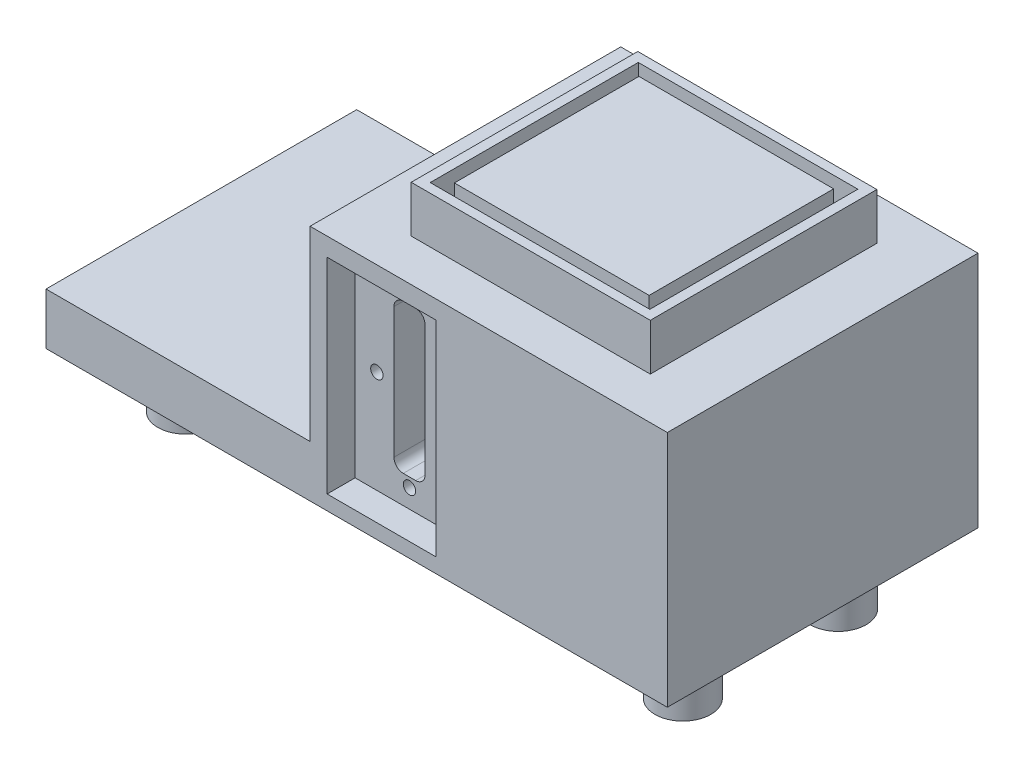
from build123d import *

# Parameters (mm, degrees)
SKETCH1_W            = 115
SKETCH1_H            = 100
BOSS_EXTRUDE1_DEPTH  = 40
SKETCH8_R            = 7
SKETCH8_R_2          = 6
BOSS_EXTRUDE4_DEPTH  = 20
SKETCH9_W            = 200
SKETCH9_H            = 100
BOSS_EXTRUDE5_DEPTH  = 16.6
SKETCH10_R           = 9
SKETCH10_R_2         = 10
BOSS_EXTRUDE7_DEPTH  = 20
SKETCH17_W           = 15
SKETCH17_H           = 100
BOSS_EXTRUDE15_DEPTH = 20
SKETCH15_R           = 14.5
CUT_EXTRUDE2_DEPTH   = 10
SKETCH21_R           = 2
SKETCH21_R_2         = 6.075
CUT_EXTRUDE3_DEPTH   = 20
SKETCH28_W           = 100
SKETCH28_H           = 100
BOSS_EXTRUDE16_DEPTH = 20
SKETCH19_R           = 2
CUT_EXTRUDE4_DEPTH   = 40
SKETCH11_W           = 76.96
SKETCH11_H           = 72.932737716
SKETCH11_W_2         = 70.68
SKETCH11_H_2         = 66.981365666
SKETCH11_W_3         = 62.68
SKETCH11_H_3         = 59.4
BOSS_EXTRUDE17_DEPTH = 15
SKETCH35_W           = 15
SKETCH35_H           = 3
SKETCH35_W_2         = 3
SKETCH35_H_2         = 15
CUT_EXTRUDE14_DEPTH  = 3
SKETCH36_W           = 10
SKETCH36_H           = 48
CUT_EXTRUDE15_DEPTH  = 32
CUT_EXTRUDE16_DEPTH  = 3
FILLET1_R            = 3
SKETCH42_W           = 35
SKETCH42_H           = 66
CUT_EXTRUDE20_DEPTH  = 9
SKETCH43_R           = 2
CUT_EXTRUDE21_DEPTH  = 9
SKETCH45_W           = 10
SKETCH45_H           = 48
CUT_EXTRUDE22_DEPTH  = 32
CUT_EXTRUDE23_DEPTH  = 3
FILLET2_R            = 3
SKETCH47_W           = 35
SKETCH47_H           = 66
CUT_EXTRUDE24_DEPTH  = 9
SKETCH48_R           = 2
CUT_EXTRUDE25_DEPTH  = 9


with BuildPart() as part:
    # Sketch1 → Boss-Extrude1 (new body)
    with BuildSketch(Plane(origin=(0, 0, 0), x_dir=(1, 0, 0), z_dir=(0, 1, 0))):
        Rectangle(SKETCH1_W, SKETCH1_H)
    extrude(amount=BOSS_EXTRUDE1_DEPTH)

    # Sketch8 → Boss-Extrude4 (add)
    with BuildSketch(Plane.XZ):
        with Locations(Location((0, 0, 0), (0, 0, 90))):
            Circle(SKETCH8_R)
        with Locations(Location((42.407889557, -36.876425702, 0), (0, 0, 90))):
            Circle(SKETCH8_R_2)
        with Locations(Location((42.407889557, 36.876425702, 0), (0, 0, 90))):
            Circle(SKETCH8_R_2)
    extrude(amount=BOSS_EXTRUDE4_DEPTH)

    # Sketch9 → Boss-Extrude5 (add)
    with BuildSketch(Plane.XZ.offset(20)):
        with Locations((-42.5, 0)):
            Rectangle(SKETCH9_W, SKETCH9_H)
    extrude(amount=BOSS_EXTRUDE5_DEPTH)

    # Sketch10 → Boss-Extrude7 (add)
    with BuildSketch(Plane.XZ.offset(36.6)):
        with Locations(Location((37.5, -25, 0), (0, 0, 270))):
            Circle(SKETCH10_R)
        with Locations(Location((-122.5, -25, 0), (0, 0, 90))):
            Circle(SKETCH10_R)
        with Locations(Location((-122.5, 25, 0), (0, 0, 270))):
            Circle(SKETCH10_R)
        with Locations(Location((37.5, 25, 0), (0, 0, 90))):
            Circle(SKETCH10_R)
        with Locations(Location((-42.5, 0, 0), (0, 0, 270))):
            Circle(SKETCH10_R_2)
    extrude(amount=BOSS_EXTRUDE7_DEPTH)

    # Sketch17 → Boss-Extrude15 (add)
    with BuildSketch(Plane.XZ):
        with Locations((-50, 0)):
            Rectangle(SKETCH17_W, SKETCH17_H)
    extrude(amount=BOSS_EXTRUDE15_DEPTH)

    # Sketch15 → Cut-Extrude2 (cut)
    with BuildSketch(Plane(origin=(0, -20, 0), x_dir=(1, 0, 0), z_dir=(0, 1, 0))):
        with Locations(Location((-79, 0, 0), (0, 0, 270))):
            Circle(SKETCH15_R)
    extrude(amount=-CUT_EXTRUDE2_DEPTH, mode=Mode.SUBTRACT)

    # Sketch21 → Cut-Extrude3 (cut)
    with BuildSketch(Plane(origin=(0, -30, 0), x_dir=(1, 0, 0), z_dir=(0, 1, 0))):
        with Locations(Location((-90, 0, 0), (0, 0, 270))):
            Circle(SKETCH21_R)
        with Locations(Location((-68, 0, 0), (0, 0, 270))):
            Circle(SKETCH21_R)
        with Locations(Location((-79, 0, 0), (0, 0, 270))):
            Circle(SKETCH21_R_2)
    extrude(amount=-CUT_EXTRUDE3_DEPTH, mode=Mode.SUBTRACT)

    # Sketch28 → Boss-Extrude16 (add)
    with BuildSketch(Plane.XZ):
        with Locations((7.5, 0)):
            Rectangle(SKETCH28_W, SKETCH28_H)
    extrude(amount=BOSS_EXTRUDE16_DEPTH)

    # Sketch19 → Cut-Extrude4 (cut)
    with BuildSketch(Plane.ZY.offset(57.5)):
        with Locations((-27.33, -16)):
            Circle(SKETCH19_R)
        with Locations((-27.33, 10)):
            Circle(SKETCH19_R)
        with Locations(Location((27.33, -16, 0), (0, 0, 180))):
            Circle(SKETCH19_R)
        with Locations(Location((27.33, 10, 0), (0, 0, 180))):
            Circle(SKETCH19_R)
    extrude(amount=-CUT_EXTRUDE4_DEPTH, mode=Mode.SUBTRACT)

    # Sketch11 → Boss-Extrude17 (add)
    # profile 1 of 2: a face of its own
    with BuildSketch(Plane(origin=(0, 40, 0), x_dir=(1, 0, 0), z_dir=(0, 1, 0))):
        Rectangle(SKETCH11_W, SKETCH11_H)
        Rectangle(SKETCH11_W_2, SKETCH11_H_2, mode=Mode.SUBTRACT)
    # profile 2 of 2: a face of its own
    with BuildSketch(Plane(origin=(0, 40, 0), x_dir=(1, 0, 0), z_dir=(0, 1, 0))):
        Rectangle(SKETCH11_W_3, SKETCH11_H_3)
    extrude(amount=BOSS_EXTRUDE17_DEPTH)

    # Sketch35 → Cut-Extrude14 (cut)
    with BuildSketch(Plane(origin=(0, 40, 0), x_dir=(1, 0, 0), z_dir=(0, 1, 0))):
        with Locations((-15.2, -31.590682833)):
            Rectangle(SKETCH35_W, SKETCH35_H)
        with Locations((-15.2, 31.590682833)):
            Rectangle(SKETCH35_W, SKETCH35_H)
        with Locations((15.2, -31.590682833)):
            Rectangle(SKETCH35_W, SKETCH35_H)
        with Locations((15.2, 31.590682833)):
            Rectangle(SKETCH35_W, SKETCH35_H)
        with Locations((-33.34, 15)):
            Rectangle(SKETCH35_W_2, SKETCH35_H_2)
        with Locations((-33.34, -15)):
            Rectangle(SKETCH35_W_2, SKETCH35_H_2)
        with Locations((33.34, 15)):
            Rectangle(SKETCH35_W_2, SKETCH35_H_2)
        with Locations((33.34, -15)):
            Rectangle(SKETCH35_W_2, SKETCH35_H_2)
    extrude(amount=-CUT_EXTRUDE14_DEPTH, mode=Mode.SUBTRACT)

    # Sketch36 → Cut-Extrude15 (cut)
    with BuildSketch(Plane.XY.offset(50)):
        with Locations((-34.5, 1.107079448)):
            Rectangle(SKETCH36_W, SKETCH36_H)
    extrude(amount=-CUT_EXTRUDE15_DEPTH, mode=Mode.SUBTRACT)

    # Sketch37 → Cut-Extrude16 (cut)
    with BuildSketch(Plane(origin=(-39.5, 0, 0), x_dir=(0, 0, -1), z_dir=(1, 0, 0))):
        Polygon((-29.206388375, 13.25), (-31.08277675, 10), (-29.206388375, 6.75), (-25.453611625, 6.75), (-23.57722325, 10), (-25.453611625, 13.25), align=None)
        Polygon((-29.206388375, -12.75), (-31.08277675, -16), (-29.206388375, -19.25), (-25.453611625, -19.25), (-23.57722325, -16), (-25.453611625, -12.75), align=None)
    extrude(amount=-CUT_EXTRUDE16_DEPTH, mode=Mode.SUBTRACT)

    # Fillet1
    fillet1_edges = [part.edges().sort_by_distance(p)[0] for p in [
        (-39.5, 1.107079448, 18),
        (-39.5, -22.892920552, 34),
        (-29.5, 1.107079448, 18),
        (-29.5, 25.107079448, 34),
        (-34.5, 25.107079448, 18),
        (-39.5, 25.107079448, 34),
        (-29.5, -22.892920552, 34),
    ]]
    fillet(fillet1_edges, radius=FILLET1_R)

    # Sketch42 → Cut-Extrude20 (cut)
    with BuildSketch(Plane.XY.offset(50)):
        with Locations((-34.5, 1.107079448)):
            Rectangle(SKETCH42_W, SKETCH42_H)
    extrude(amount=-CUT_EXTRUDE20_DEPTH, mode=Mode.SUBTRACT)

    # Sketch43 → Cut-Extrude21 (cut)
    with BuildSketch(Plane.XY.offset(41)):
        with Locations((-34.5, 28.107079448)):
            Circle(SKETCH43_R)
        with Locations((-24, 1.107079448)):
            Circle(SKETCH43_R)
        with Locations(Location((-34.5, -25.892920552, 0), (0, 0, 180))):
            Circle(SKETCH43_R)
        with Locations(Location((-45, 1.107079448, 0), (0, 0, 180))):
            Circle(SKETCH43_R)
    extrude(amount=-CUT_EXTRUDE21_DEPTH, mode=Mode.SUBTRACT)

    # Sketch45 → Cut-Extrude22 (cut)
    with BuildSketch(Plane(origin=(0, 0, -50), x_dir=(-1, 0, 0), z_dir=(0, 0, -1))):
        with Locations((34.5, 1.11)):
            Rectangle(SKETCH45_W, SKETCH45_H)
    extrude(amount=-CUT_EXTRUDE22_DEPTH, mode=Mode.SUBTRACT)

    # Sketch46 → Cut-Extrude23 (cut)
    with BuildSketch(Plane(origin=(-39.5, 0, 0), x_dir=(0, 0, -1), z_dir=(1, 0, 0))):
        Polygon((29.206388375, 13.25), (25.453611625, 13.25), (23.57722325, 10), (25.453611625, 6.75), (29.206388375, 6.75), (31.08277675, 10), align=None)
        Polygon((25.453611625, -12.75), (23.57722325, -16), (25.453611625, -19.25), (29.206388375, -19.25), (31.08277675, -16), (29.206388375, -12.75), align=None)
    extrude(amount=-CUT_EXTRUDE23_DEPTH, mode=Mode.SUBTRACT)

    # Fillet2
    fillet2_edges = [part.edges().sort_by_distance(p)[0] for p in [
        (-29.5, 1.11, -18),
        (-29.5, -22.89, -34),
        (-39.5, 1.11, -18),
        (-39.5, 25.11, -34),
        (-34.5, 25.11, -18),
        (-29.5, 25.11, -34),
        (-34.5, -22.89, -18),
        (-39.5, -22.89, -34),
    ]]
    fillet(fillet2_edges, radius=FILLET2_R)

    # Sketch47 → Cut-Extrude24 (cut)
    with BuildSketch(Plane(origin=(0, 0, -50), x_dir=(-1, 0, 0), z_dir=(0, 0, -1))):
        with Locations((34.5, 1.11)):
            Rectangle(SKETCH47_W, SKETCH47_H)
    extrude(amount=-CUT_EXTRUDE24_DEPTH, mode=Mode.SUBTRACT)

    # Sketch48 → Cut-Extrude25 (cut)
    with BuildSketch(Plane(origin=(0, 0, -41), x_dir=(-1, 0, 0), z_dir=(0, 0, -1))):
        with Locations((34.5, 28.11)):
            Circle(SKETCH48_R)
        with Locations((45, 1.11)):
            Circle(SKETCH48_R)
        with Locations(Location((24, 1.11, 0), (0, 0, 180))):
            Circle(SKETCH48_R)
        with Locations(Location((34.5, -25.89, 0), (0, 0, 180))):
            Circle(SKETCH48_R)
    extrude(amount=-CUT_EXTRUDE25_DEPTH, mode=Mode.SUBTRACT)


solid = part.part
